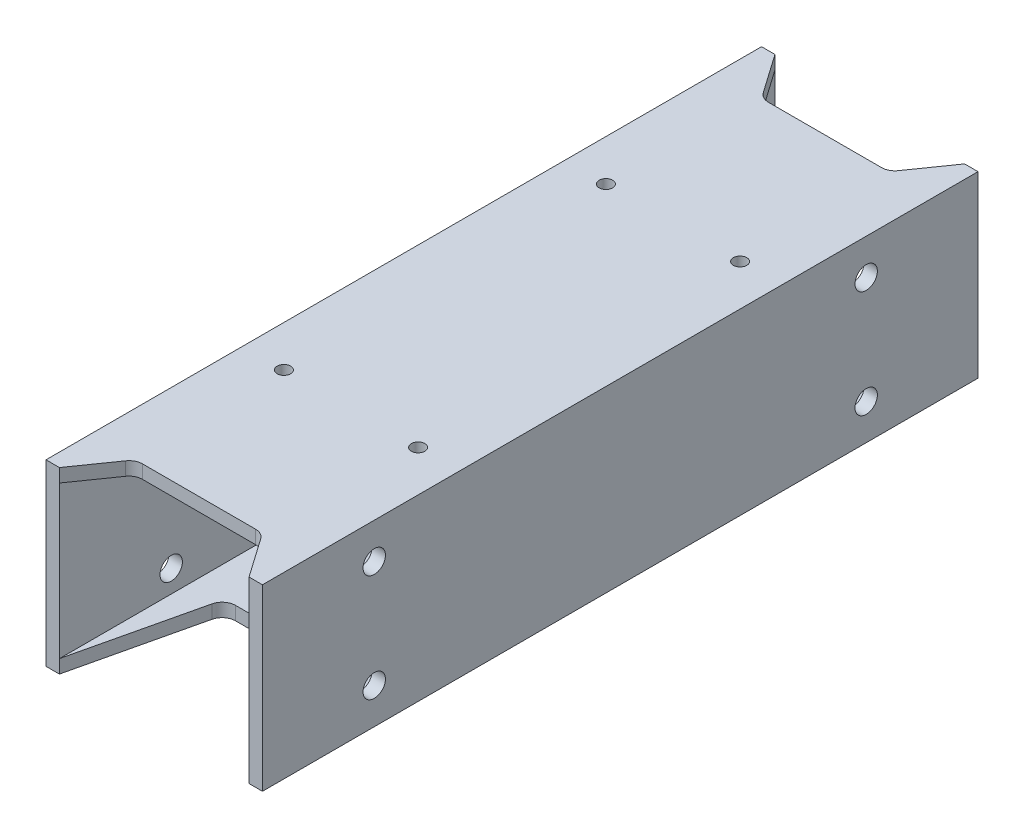
from build123d import *

# Parameters (mm, degrees)
SKETCH_1_W          = 48.4
SKETCH_1_H          = 40
SKETCH_1_W_2        = 42.4
SKETCH_1_H_2        = 34
EXTRUDE_1_DEPTH     = 160
SKETCH_2_R          = 2.5
CUT_EXTRUDE_1_DEPTH = 18
CUT_EXTRUDE_START   = -10
SKETCH_4_R          = 2.5
CUT_EXTRUDE_3_DEPTH = 10
SKETCH_8_R          = 1.5
CUT_EXTRUDE_6_DEPTH = 50
CUT_EXTRUDE_7_DEPTH = 10
FILLET_1_R          = 3
CUT_EXTRUDE_8_DEPTH = 10
FILLET_2_R          = 3


with BuildPart() as part:
    # 草图1 → 凸台-拉伸1 (new body)
    with BuildSketch(Plane.XY):
        Rectangle(SKETCH_1_W, SKETCH_1_H)
        Rectangle(SKETCH_1_W_2, SKETCH_1_H_2, mode=Mode.SUBTRACT)
    extrude(amount=EXTRUDE_1_DEPTH)

    # 草图2 → 切除-拉伸1 (cut)
    with BuildSketch(Plane(origin=(24.2, 0, 0), x_dir=(0, 0, -1), z_dir=(1, 0, 0))):
        with Locations((-135, 12)):
            Circle(SKETCH_2_R)
        with Locations((-135, -12)):
            Circle(SKETCH_2_R)
        with Locations((-25, 12)):
            Circle(SKETCH_2_R)
        with Locations((-25, -12)):
            Circle(SKETCH_2_R)
    extrude(amount=-CUT_EXTRUDE_1_DEPTH, mode=Mode.SUBTRACT)

    # 草图4 → 切除-拉伸3 (cut)
    with BuildSketch(Plane.ZY.offset(24.2).offset(CUT_EXTRUDE_START)):
        with Locations(Location((25, 12, 0), (0, 0, 180))):
            Circle(SKETCH_4_R)
        with Locations(Location((25, -12, 0), (0, 0, 180))):
            Circle(SKETCH_4_R)
        with Locations(Location((135, 12, 0), (0, 0, 180))):
            Circle(SKETCH_4_R)
        with Locations(Location((135, -12, 0), (0, 0, 180))):
            Circle(SKETCH_4_R)
    extrude(amount=CUT_EXTRUDE_3_DEPTH, mode=Mode.SUBTRACT)

    # 草图8 → 切除-拉伸6 (cut)
    with BuildSketch(Plane(origin=(0, 20, 0), x_dir=(1, 0, 0), z_dir=(0, 1, 0))):
        with Locations(Location((-15, -44, 0), (0, 0, 180))):
            Circle(SKETCH_8_R)
        with Locations(Location((15, -44, 0), (0, 0, 180))):
            Circle(SKETCH_8_R)
        with Locations(Location((-15, -116, 0), (0, 0, 180))):
            Circle(SKETCH_8_R)
        with Locations(Location((15, -116, 0), (0, 0, 180))):
            Circle(SKETCH_8_R)
    extrude(amount=-CUT_EXTRUDE_6_DEPTH, mode=Mode.SUBTRACT)

    # 草图9 → 切除-拉伸7 (cut)
    with BuildSketch(Plane.XZ.offset(20)):
        Polygon((-21.2, 160), (-14.2, 130), (14.2, 130), (21.2, 160), align=None)
        Polygon((21.2, 0), (-21.2, 0), (-14.2, 30), (14.2, 30), align=None)
    extrude(amount=-CUT_EXTRUDE_7_DEPTH, mode=Mode.SUBTRACT)

    # 圆角1
    fillet_1_edges = [part.edges().sort_by_distance(p)[0] for p in [
        (14.2, -18.5, 130),
        (-14.2, -18.5, 130),
        (-14.2, -18.5, 30),
        (14.2, -18.5, 30),
    ]]
    fillet(fillet_1_edges, radius=FILLET_1_R)

    # 草图10 → 切除-拉伸8 (cut)
    with BuildSketch(Plane(origin=(0, 20, 0), x_dir=(1, 0, 0), z_dir=(0, 1, 0))):
        Polygon((-21.2, 0), (-14.2, -10), (14.2, -10), (21.2, 0), align=None)
        Polygon((21.2, -160), (-21.2, -160), (-14.2, -150), (14.2, -150), align=None)
    extrude(amount=-CUT_EXTRUDE_8_DEPTH, mode=Mode.SUBTRACT)

    # 圆角2
    fillet_2_edges = [part.edges().sort_by_distance(p)[0] for p in [
        (14.2, 18.5, 10),
        (-14.2, 18.5, 10),
        (14.2, 18.5, 150),
        (-14.2, 18.5, 150),
    ]]
    fillet(fillet_2_edges, radius=FILLET_2_R)


solid = part.part
